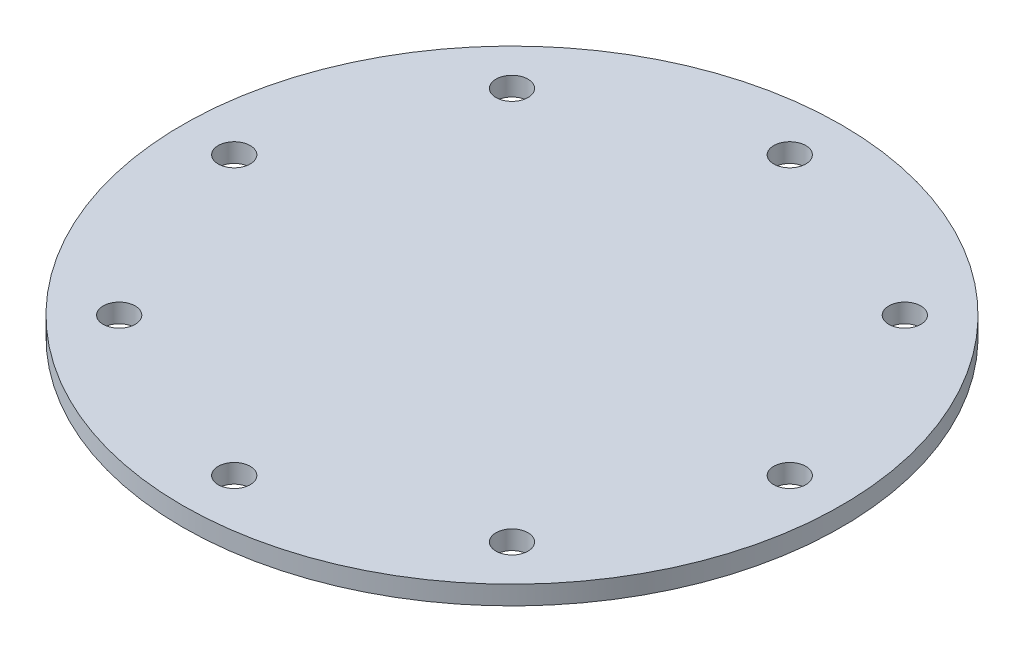
from build123d import *

# Parameters (mm, degrees)
SKETCH_1_R      = 70
SKETCH_1_R_2    = 3.4
EXTRUDE_1_DEPTH = 4


with BuildPart() as part:
    # Эскиз1 → Бобышка-Вытянуть1 (new body)
    with BuildSketch(Plane(origin=(0, 0, 0), x_dir=(1, 0, 0), z_dir=(0, 1, 0))):
        with Locations(Location((0, 0, 0), (0, 0, 270))):
            Circle(SKETCH_1_R)
        with Locations(Location((59, 0, 0), (0, 0, 270))):
            Circle(SKETCH_1_R_2, mode=Mode.SUBTRACT)
        with Locations(Location((41.71930009, -41.71930009, 0), (0, 0, 270))):
            Circle(SKETCH_1_R_2, mode=Mode.SUBTRACT)
        with Locations(Location((0, -59, 0), (0, 0, 270))):
            Circle(SKETCH_1_R_2, mode=Mode.SUBTRACT)
        with Locations(Location((-41.71930009, -41.71930009, 0), (0, 0, 270))):
            Circle(SKETCH_1_R_2, mode=Mode.SUBTRACT)
        with Locations(Location((-59, 0, 0), (0, 0, 270))):
            Circle(SKETCH_1_R_2, mode=Mode.SUBTRACT)
        with Locations(Location((-41.71930009, 41.71930009, 0), (0, 0, 270))):
            Circle(SKETCH_1_R_2, mode=Mode.SUBTRACT)
        with Locations(Location((0, 59, 0), (0, 0, 270))):
            Circle(SKETCH_1_R_2, mode=Mode.SUBTRACT)
        with Locations(Location((41.71930009, 41.71930009, 0), (0, 0, 270))):
            Circle(SKETCH_1_R_2, mode=Mode.SUBTRACT)
    extrude(amount=EXTRUDE_1_DEPTH)


solid = part.part
